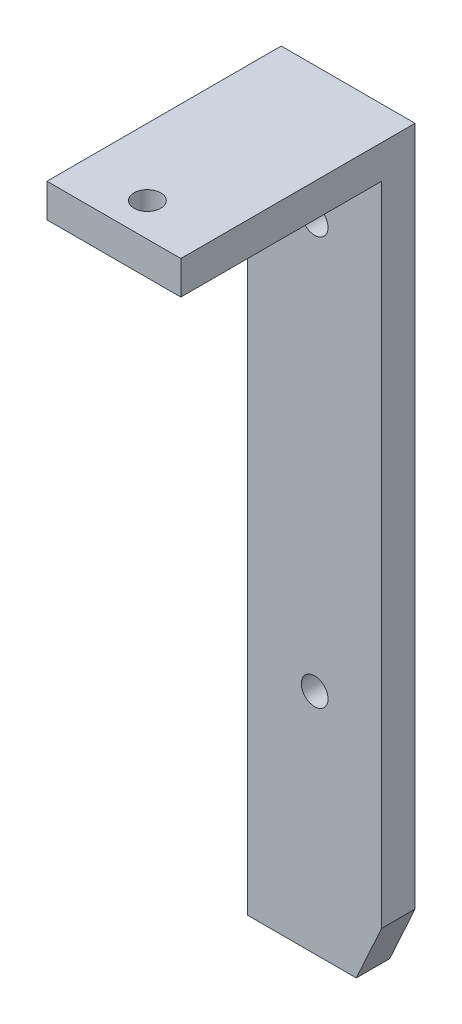
from build123d import *

# Parameters (mm, degrees)
SKETCH1_W           = 12.7
SKETCH1_H           = 3.175
BOSS_EXTRUDE1_DEPTH = 69.85
SKETCH2_W           = 12.7
SKETCH2_H           = 3.175
BOSS_EXTRUDE2_DEPTH = 19.05
SKETCH3_R           = 1.27
CUT_EXTRUDE1_DEPTH  = 71.084124673
SKETCH4_R           = 1.27
CUT_EXTRUDE2_DEPTH  = 73.679071953
CUT_EXTRUDE3_DEPTH  = 73.679071953


with BuildPart() as part:
    # Sketch1 → Boss-Extrude1 (new body)
    with BuildSketch(Plane(origin=(0, 0, 0), x_dir=(1, 0, 0), z_dir=(0, 1, 0))):
        Rectangle(SKETCH1_W, SKETCH1_H)
    extrude(amount=BOSS_EXTRUDE1_DEPTH)

    # Sketch2 → Boss-Extrude2 (add)
    with BuildSketch(Plane.XY.offset(1.5875)):
        with Locations((0, 68.2625)):
            Rectangle(SKETCH2_W, SKETCH2_H)
    extrude(amount=BOSS_EXTRUDE2_DEPTH)

    # Sketch3 → Cut-Extrude1 (cut, through all)
    with BuildSketch(Plane.XZ.offset(-66.675)):
        with Locations(Location((0, 17.4625, 0), (0, 0, 270))):
            Circle(SKETCH3_R)
    extrude(amount=-CUT_EXTRUDE1_DEPTH, mode=Mode.SUBTRACT)

    # Sketch4 → Cut-Extrude2 (cut, through all)
    with BuildSketch(Plane.XY.offset(1.5875)):
        with Locations((0, 21.59)):
            Circle(SKETCH4_R)
        with Locations((0, 60.325)):
            Circle(SKETCH4_R)
    extrude(amount=-CUT_EXTRUDE2_DEPTH, mode=Mode.SUBTRACT)

    # Sketch6 → Cut-Extrude3 (cut, through all)
    with BuildSketch(Plane.XY.offset(1.5875)):
        Polygon((3.951482723, 0), (6.35, 5.27166953), (6.35, 0), align=None)
    extrude(amount=-CUT_EXTRUDE3_DEPTH, mode=Mode.SUBTRACT)


solid = part.part
